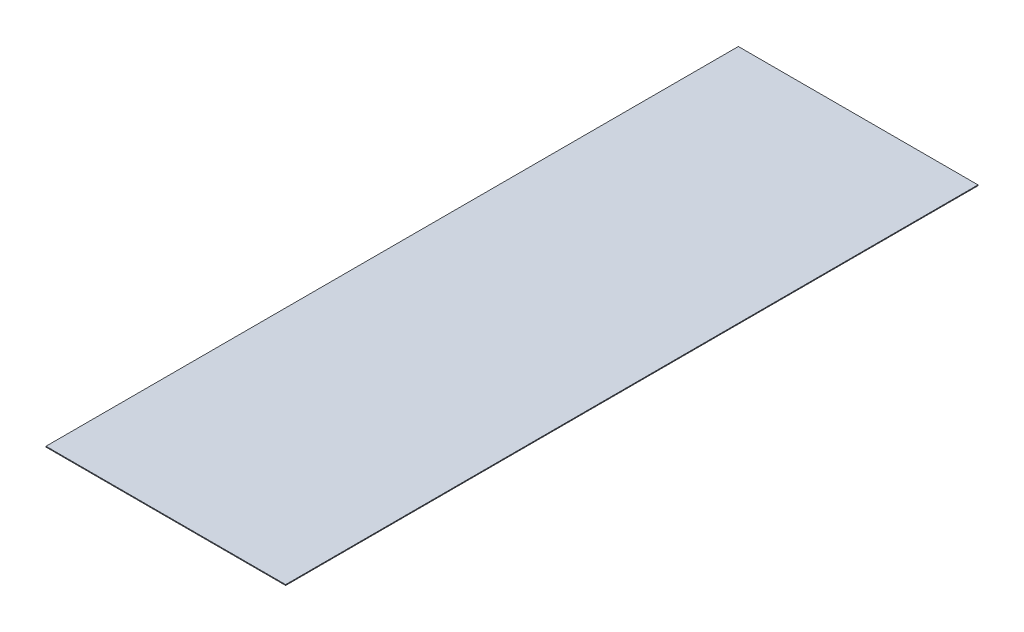
from build123d import *

# Parameters (mm, degrees)
SKETCH142_W         = 900
SKETCH142_H         = 2600
BOSS_EXTRUDE1_DEPTH = 3


with BuildPart() as part:
    # Sketch142 → Boss-Extrude1 (new body)
    with BuildSketch(Plane(origin=(0, 0, 0), x_dir=(1, 0, 0), z_dir=(0, 1, 0))):
        with Locations((0, 293.830207092)):
            Rectangle(SKETCH142_W, SKETCH142_H)
    extrude(amount=BOSS_EXTRUDE1_DEPTH)


solid = part.part
